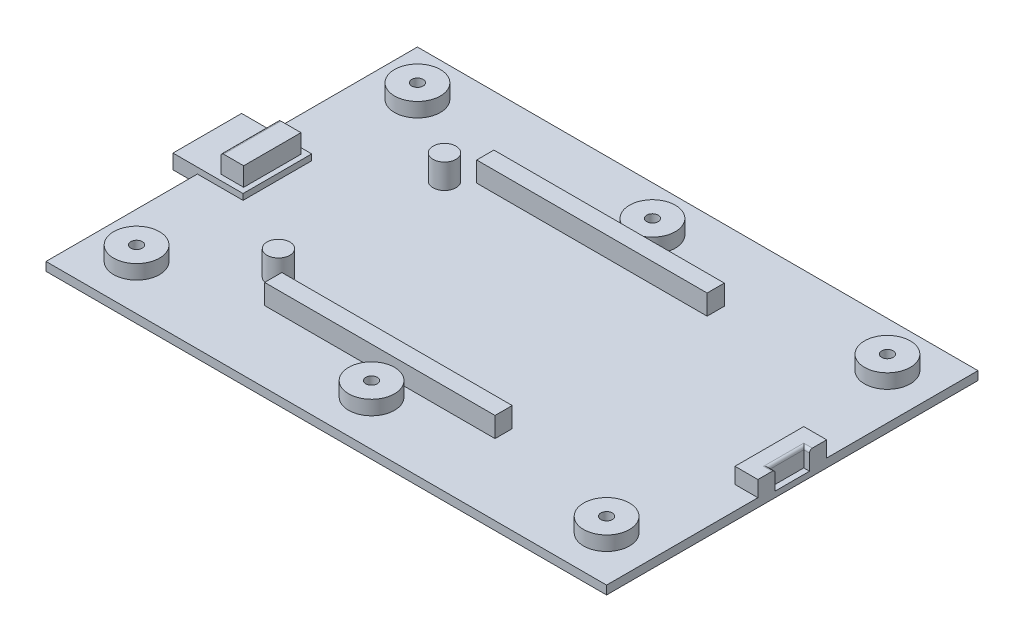
from build123d import *

# Parameters (mm, degrees)
EXTRUDE_1_DEPTH     = 1.5
SKETCH_2_R          = 5
CUT_EXTRUDE_1_DEPTH = 0.5
SKETCH_11_R         = 2
SKETCH_11_W         = 12.230000074
SKETCH_11_H         = 11.974599949
EXTRUDE_5_DEPTH     = 2.539974634
SKETCH_13_R         = 2
SKETCH_13_W         = 4
SKETCH_13_H         = 10
TYPEC_2_DEPTH       = 5.7999746
LED_3_START         = -4.25
LED_3_DEPTH         = 2.75
LED_1_R             = 0.5
CUT_EXTRUDE_2_REACH = 75.864
SKETCH_15_R         = 2
EXTRUDE_START       = -4
SKETCH_16_R         = 4
SKETCH_16_R_2       = 1
EXTRUDE_4_DEPTH     = 2.5
LED_2_START         = -1.5
SKETCH_17_W         = 1
SKETCH_17_H         = 6
LED_2_DEPTH         = 0.5
SKETCH_18_W         = 40.2
SKETCH_18_H         = 3
EXTRUDE_2_DEPTH     = 3.5


with BuildPart() as part:
    # 草图1 → 凸台-拉伸1 (new body)
    with BuildSketch(Plane(origin=(0, 0, 0), x_dir=(1, 0, 0), z_dir=(0, 1, 0))):
        Polygon((-51.714401712, -9.454370264), (-55.976720775, -9.454370264), (-55.976720775, -21.428970213), (-51.714401712, -21.428970213), (-51.714401712, -47.841670238), (46.085598288, -47.841670238), (46.085598288, 16.958329762), (-51.714401712, 16.958329762), align=None)
    extrude(amount=EXTRUDE_1_DEPTH)

    # 草图2 → 防滑切除-拉伸1 (cut)
    with BuildSketch(Plane.XZ):
        with Locations(Location((-43.814401712, 39.941670238, 0), (0, 0, 270))):
            Circle(SKETCH_2_R)
        with Locations(Location((38.185598288, 39.941670238, 0), (0, 0, 90))):
            Circle(SKETCH_2_R)
        with Locations(Location((38.185598288, -9.058329762, 0), (0, 0, 90))):
            Circle(SKETCH_2_R)
        with Locations(Location((-43.814401712, -9.058329762, 0), (0, 0, 270))):
            Circle(SKETCH_2_R)
    extrude(amount=-CUT_EXTRUDE_1_DEPTH, mode=Mode.SUBTRACT)

    # 草图11 → 充电板档板凸台-拉伸5 (add)
    with BuildSketch(Plane.XZ):
        with Locations((-29.074401712, 29.928970213)):
            Circle(SKETCH_11_R)
        with Locations((-29.074401712, 0.954370264)):
            Circle(SKETCH_11_R)
        with Locations((-49.861720738, 15.441670239)):
            Rectangle(SKETCH_11_W, SKETCH_11_H)
    extrude(amount=-EXTRUDE_5_DEPTH)

    # 草图13 → TypeC支撑凸台-拉伸2 (add)
    with BuildSketch(Plane.XZ):
        with Locations(Location((-29.074401712, 29.928970213, 0), (0, 0, 90))):
            Circle(SKETCH_13_R)
        with Locations(Location((-29.074401712, 0.954370264, 0), (0, 0, 90))):
            Circle(SKETCH_13_R)
        with Locations((-46.626720701, 15.441670238)):
            Rectangle(SKETCH_13_W, SKETCH_13_H)
    extrude(amount=-TYPEC_2_DEPTH)

    # 草图14 → LED限位凸台-拉伸3 (add)
    with BuildSketch(Plane.XZ.offset(LED_3_START)):
        Polygon((45.085598288, 12.441670238), (45.085598288, 18.441670238), (46.085598288, 18.441670238), (46.085598288, 21.441670238), (42.085598288, 21.441670238), (42.085598288, 9.441670238), (46.085598288, 9.441670238), (46.085598288, 12.441670238), align=None)
    extrude(amount=LED_3_DEPTH)

    # LED限位圆角1
    led_1_edges = [part.edges().sort_by_distance(p)[0] for p in [
        (45.585598288, 4.25, 18.441670238),
        (45.585598288, 4.25, 12.441670238),
        (45.085598288, 4.25, 15.441670238),
        (-48.626720701, 5.7999746, 15.441670238),
    ]]
    fillet(led_1_edges, radius=LED_1_R)

    # 草图15 → 螺丝孔位切除-拉伸2 (cut, up to next)
    with BuildSketch(Plane.XZ, mode=Mode.PRIVATE) as cut_extrude_2_sk1:
        with Locations(Location((-43.814401712, -9.058329762, 0), (0, 0, 270))):
            Circle(SKETCH_15_R)
    cut_extrude_2_tool1 = extrude(cut_extrude_2_sk1.sketch, amount=-CUT_EXTRUDE_2_REACH, mode=Mode.PRIVATE) & part.part
    # 草图15 → 螺丝孔位切除-拉伸2 (cut, up to next)
    with BuildSketch(Plane.XZ, mode=Mode.PRIVATE) as cut_extrude_2_sk2:
        with Locations(Location((-43.814401712, 39.941670238, 0), (0, 0, 270))):
            Circle(SKETCH_15_R)
    cut_extrude_2_tool2 = extrude(cut_extrude_2_sk2.sketch, amount=-CUT_EXTRUDE_2_REACH, mode=Mode.PRIVATE) & part.part
    # 草图15 → 螺丝孔位切除-拉伸2 (cut, up to next)
    with BuildSketch(Plane.XZ, mode=Mode.PRIVATE) as cut_extrude_2_sk3:
        with Locations(Location((38.185598288, -9.058329762, 0), (0, 0, 270))):
            Circle(SKETCH_15_R)
    cut_extrude_2_tool3 = extrude(cut_extrude_2_sk3.sketch, amount=-CUT_EXTRUDE_2_REACH, mode=Mode.PRIVATE) & part.part
    # 草图15 → 螺丝孔位切除-拉伸2 (cut, up to next)
    with BuildSketch(Plane.XZ, mode=Mode.PRIVATE) as cut_extrude_2_sk4:
        with Locations(Location((38.185598288, 39.941670238, 0), (0, 0, 270))):
            Circle(SKETCH_15_R)
    cut_extrude_2_tool4 = extrude(cut_extrude_2_sk4.sketch, amount=-CUT_EXTRUDE_2_REACH, mode=Mode.PRIVATE) & part.part
    # 草图15 → 螺丝孔位切除-拉伸2 (cut, up to next)
    with BuildSketch(Plane.XZ, mode=Mode.PRIVATE) as cut_extrude_2_sk5:
        with Locations(Location((-2.814401712, 39.941670238, 0), (0, 0, 270))):
            Circle(SKETCH_15_R)
    cut_extrude_2_tool5 = extrude(cut_extrude_2_sk5.sketch, amount=-CUT_EXTRUDE_2_REACH, mode=Mode.PRIVATE) & part.part
    # 草图15 → 螺丝孔位切除-拉伸2 (cut, up to next)
    with BuildSketch(Plane.XZ, mode=Mode.PRIVATE) as cut_extrude_2_sk6:
        with Locations(Location((-2.814401712, -9.058329762, 0), (0, 0, 270))):
            Circle(SKETCH_15_R)
    cut_extrude_2_tool6 = extrude(cut_extrude_2_sk6.sketch, amount=-CUT_EXTRUDE_2_REACH, mode=Mode.PRIVATE) & part.part
    add(cut_extrude_2_tool1.solids().sort_by_distance((-43.814402, 0, -9.05833))[0], mode=Mode.SUBTRACT)
    add(cut_extrude_2_tool2.solids().sort_by_distance((-43.814402, 0, 39.94167))[0], mode=Mode.SUBTRACT)
    add(cut_extrude_2_tool3.solids().sort_by_distance((38.185598, 0, -9.05833))[0], mode=Mode.SUBTRACT)
    add(cut_extrude_2_tool4.solids().sort_by_distance((38.185598, 0, 39.94167))[0], mode=Mode.SUBTRACT)
    add(cut_extrude_2_tool5.solids().sort_by_distance((-2.814402, 0, 39.94167))[0], mode=Mode.SUBTRACT)
    add(cut_extrude_2_tool6.solids().sort_by_distance((-2.814402, 0, -9.05833))[0], mode=Mode.SUBTRACT)

    # 草图16 → 螺丝孔凸台-拉伸4 (add)
    # profile 1 of 6: a face of its own
    with BuildSketch(Plane.XZ.offset(EXTRUDE_START)):
        with Locations(Location((38.185598288, -9.058329762, 0), (0, 0, 270))):
            Circle(SKETCH_16_R)
        with Locations(Location((38.185598288, -9.058329762, 0), (0, 0, 270))):
            Circle(SKETCH_16_R_2, mode=Mode.SUBTRACT)
    # profile 2 of 6: a face of its own
    with BuildSketch(Plane.XZ.offset(EXTRUDE_START)):
        with Locations(Location((38.185598288, 39.941670238, 0), (0, 0, 270))):
            Circle(SKETCH_16_R)
        with Locations(Location((38.185598288, 39.941670238, 0), (0, 0, 270))):
            Circle(SKETCH_16_R_2, mode=Mode.SUBTRACT)
    # profile 3 of 6: a face of its own
    with BuildSketch(Plane.XZ.offset(EXTRUDE_START)):
        with Locations(Location((-43.814401712, -9.058329762, 0), (0, 0, 270))):
            Circle(SKETCH_16_R)
        with Locations(Location((-43.814401712, -9.058329762, 0), (0, 0, 270))):
            Circle(SKETCH_16_R_2, mode=Mode.SUBTRACT)
    # profile 4 of 6: a face of its own
    with BuildSketch(Plane.XZ.offset(EXTRUDE_START)):
        with Locations(Location((-43.814401712, 39.941670238, 0), (0, 0, 270))):
            Circle(SKETCH_16_R)
        with Locations(Location((-43.814401712, 39.941670238, 0), (0, 0, 270))):
            Circle(SKETCH_16_R_2, mode=Mode.SUBTRACT)
    # profile 5 of 6: a face of its own
    with BuildSketch(Plane.XZ.offset(EXTRUDE_START)):
        with Locations(Location((-2.814401712, 39.941670238, 0), (0, 0, 270))):
            Circle(SKETCH_16_R)
        with Locations(Location((-2.814401712, 39.941670238, 0), (0, 0, 270))):
            Circle(SKETCH_16_R_2, mode=Mode.SUBTRACT)
    # profile 6 of 6: a face of its own
    with BuildSketch(Plane.XZ.offset(EXTRUDE_START)):
        with Locations(Location((-2.814401712, -9.058329762, 0), (0, 0, 270))):
            Circle(SKETCH_16_R)
        with Locations(Location((-2.814401712, -9.058329762, 0), (0, 0, 270))):
            Circle(SKETCH_16_R_2, mode=Mode.SUBTRACT)
    extrude(amount=EXTRUDE_4_DEPTH)

    # 草图17 → LED灯嵌入切除-拉伸2 (cut)
    with BuildSketch(Plane.XZ.offset(LED_2_START)):
        with Locations((45.585598288, 15.441670238)):
            Rectangle(SKETCH_17_W, SKETCH_17_H)
    extrude(amount=LED_2_DEPTH, mode=Mode.SUBTRACT)

    # 草图18 → 散热板支撑凸台-拉伸2 (add)
    with BuildSketch(Plane(origin=(0, 1.5, 0), x_dir=(1, 0, 0), z_dir=(0, 1, 0))):
        with Locations((-5.874401712, 3.058329762)):
            Rectangle(SKETCH_18_W, SKETCH_18_H)
        with Locations((-5.874401712, -33.941670238)):
            Rectangle(SKETCH_18_W, SKETCH_18_H)
    extrude(amount=EXTRUDE_2_DEPTH)


solid = part.part
